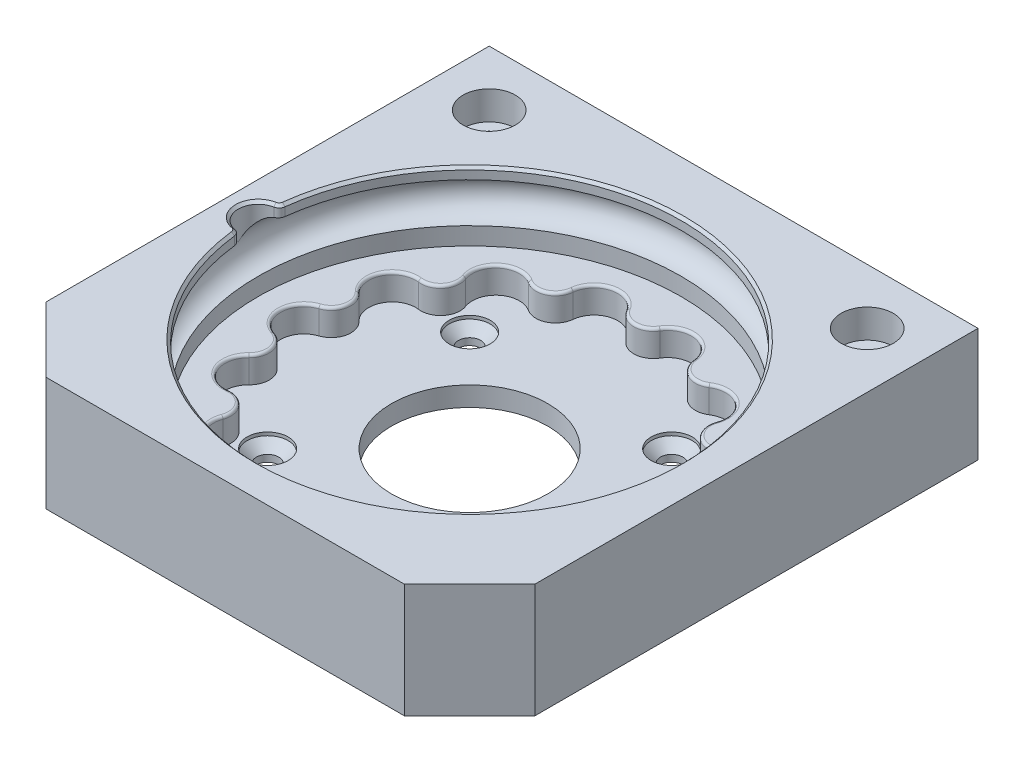
from build123d import *

# Parameters (mm, degrees)
SKETCH3_W                                           = 75
SKETCH3_H                                           = 75
SKETCH3_R                                           = 4.1
BOSS_EXTRUDE1_DEPTH                                 = 3
SKETCH4_W                                           = 75
SKETCH4_H                                           = 75
SKETCH4_R                                           = 3
BOSS_EXTRUDE2_DEPTH                                 = 4
SKETCH5_W                                           = 75
SKETCH5_H                                           = 75
SKETCH5_R                                           = 32.45
BOSS_EXTRUDE3_DEPTH                                 = 10.5
CHAMFER1_SIZE                                       = 10
SKETCH11_R                                          = 3.05
CUT_EXTRUDE2_REACH                                  = 57.846
CUT_EXTRUDE2_END_MAJOR_RADIUS                       = 32.45
CUT_EXTRUDE2_END_MINOR_RADIUS                       = 3.05
SKETCH12_R                                          = 3.05
FILLET2_R                                           = 1
SKETCH14_R                                          = 12
CUT_EXTRUDE3_DEPTH                                  = 56.845769925
CSK_FOR_M3_COUNTERSUNK_FLAT_HEAD_SCR_2_COUNT        = 2
CSK_FOR_M3_COUNTERSUNK_FLAT_HEAD_SCR_2_PITCH        = 31
CSK_FOR_M3_COUNTERSUNK_FLAT_HEAD_SCR_3_COUNT        = 2
CSK_FOR_M3_COUNTERSUNK_FLAT_HEAD_SCR_3_PITCH        = 43.840620434
CSK_FOR_M3_COUNTERSUNK_FLAT_HEAD_SCR_4_COUNT        = 2
CSK_FOR_M3_COUNTERSUNK_FLAT_HEAD_SCR_4_PITCH        = 31
CHAMFER2_SIZE                                       = 0.4
FILLET3_R                                           = 0.4
SKETCH17_W                                          = 75
SKETCH17_H                                          = 17.5
BOSS_EXTRUDE4_DEPTH                                 = 3
CBORE_FOR_M4_HEX_SOCKET_HEAD_CAP_SCREW1_D           = 4.5
CBORE_FOR_M4_HEX_SOCKET_HEAD_CAP_SCREW1_CBORE_D     = 8
CBORE_FOR_M4_HEX_SOCKET_HEAD_CAP_SCREW1_CBORE_DEPTH = 4.4


with BuildPart() as part:
    # Sketch3 → Boss-Extrude1 (new body)
    with BuildSketch(Plane(origin=(0, 0, 0), x_dir=(1, 0, 0), z_dir=(0, 1, 0))):
        Rectangle(SKETCH3_W, SKETCH3_H)
        with Locations(Location((0, 0, 0), (0, 0, 270))):
            Circle(SKETCH3_R, mode=Mode.SUBTRACT)
    extrude(amount=BOSS_EXTRUDE1_DEPTH)

    # Sketch4 → Boss-Extrude2 (add)
    # profile 1 of 15: a face of its own
    with BuildSketch(Plane(origin=(0, 3, 0), x_dir=(1, 0, 0), z_dir=(0, 1, 0))):
        Rectangle(SKETCH4_W, SKETCH4_H)
        with BuildLine():
            ThreePointArc((26.543765328, -3.429213328), (29.246876273, -3.841204002), (30.492967124, -6.275090338))
            ThreePointArc((30.492967124, -6.275090338), (28.661311449, -9.038235563), (25.402986098, -8.4272937))
            ThreePointArc((25.402986098, -8.4272937), (26.141546674, -12.589105375), (22.427226296, -14.606522601))
            ThreePointArc((22.427226296, -14.606522601), (24.299173452, -15.599830191), (25.047647806, -17.582412412))
            ThreePointArc((25.047647806, -17.582412412), (22.571841643, -20.536260889), (19.230833925, -18.614671858))
            ThreePointArc((19.230833925, -18.614671858), (18.0905116, -22.684784035), (13.868700044, -22.890830935))
            ThreePointArc((13.868700044, -22.890830935), (14.871762688, -23.975458919), (15.235521443, -25.407322075))
            ThreePointArc((15.235521443, -25.407322075), (12.089279525, -28.403755505), (9.249779242, -25.11518596))
            ThreePointArc((9.249779242, -25.11518596), (6.456428838, -28.287463006), (2.563307661, -26.641329465))
            ThreePointArc((2.563307661, -26.641329465), (2.8887647, -27.390655507), (3, -28.2))
            ThreePointArc((3, -28.2), (-0.809344493, -31.0887647), (-2.563307661, -26.641329465))
            ThreePointArc((-2.563307661, -26.641329465), (-6.456428838, -28.287463006), (-9.249779242, -25.11518596))
            ThreePointArc((-9.249779242, -25.11518596), (-9.239088013, -25.261080157), (-9.235521443, -25.407322075))
            ThreePointArc((-9.235521443, -25.407322075), (-13.667384599, -28.04356332), (-13.868700044, -22.890830935))
            ThreePointArc((-13.868700044, -22.890830935), (-18.0905116, -22.684784035), (-19.230833925, -18.614671858))
            ThreePointArc((-19.230833925, -18.614671858), (-24.393142253, -19.452881818), (-22.427226296, -14.606522601))
            ThreePointArc((-22.427226296, -14.606522601), (-26.141546674, -12.589105375), (-25.402986098, -8.4272937))
            ThreePointArc((-25.402986098, -8.4272937), (-30.41775086, -6.942653139), (-26.543765328, -3.429213328))
            ThreePointArc((-26.543765328, -3.429213328), (-29.014927825, 0), (-26.543765328, 3.429213328))
            ThreePointArc((-26.543765328, 3.429213328), (-30.41775086, 6.942653139), (-25.402986098, 8.4272937))
            ThreePointArc((-25.402986098, 8.4272937), (-26.141546674, 12.589105375), (-22.427226296, 14.606522601))
            ThreePointArc((-22.427226296, 14.606522601), (-24.393142253, 19.452881818), (-19.230833925, 18.614671858))
            ThreePointArc((-19.230833925, 18.614671858), (-18.0905116, 22.684784035), (-13.868700044, 22.890830935))
            ThreePointArc((-13.868700044, 22.890830935), (-13.667384599, 28.04356332), (-9.235521443, 25.407322075))
            ThreePointArc((-9.235521443, 25.407322075), (-9.239088013, 25.261080157), (-9.249779242, 25.11518596))
            ThreePointArc((-9.249779242, 25.11518596), (-6.456428838, 28.287463006), (-2.563307661, 26.641329465))
            ThreePointArc((-2.563307661, 26.641329465), (-0.809344493, 31.0887647), (3, 28.2))
            ThreePointArc((3, 28.2), (2.8887647, 27.390655507), (2.563307661, 26.641329465))
            ThreePointArc((2.563307661, 26.641329465), (6.456428838, 28.287463006), (9.249779242, 25.11518596))
            ThreePointArc((9.249779242, 25.11518596), (12.089279525, 28.403755505), (15.235521443, 25.407322075))
            ThreePointArc((15.235521443, 25.407322075), (14.871762688, 23.975458919), (13.868700044, 22.890830935))
            ThreePointArc((13.868700044, 22.890830935), (18.0905116, 22.684784035), (19.230833925, 18.614671858))
            ThreePointArc((19.230833925, 18.614671858), (22.571841643, 20.536260889), (25.047647806, 17.582412412))
            ThreePointArc((25.047647806, 17.582412412), (24.299173452, 15.599830191), (22.427226296, 14.606522601))
            ThreePointArc((22.427226296, 14.606522601), (26.141546674, 12.589105375), (25.402986098, 8.4272937))
            ThreePointArc((25.402986098, 8.4272937), (28.661311449, 9.038235563), (30.492967124, 6.275090338))
            ThreePointArc((30.492967124, 6.275090338), (29.246876273, 3.841204002), (26.543765328, 3.429213328))
            ThreePointArc((26.543765328, 3.429213328), (29.014927825, 0), (26.543765328, -3.429213328))
        make_face(mode=Mode.SUBTRACT)
    # profile 2 of 15: a face of its own
    with BuildSketch(Plane(origin=(0, 3, 0), x_dir=(1, 0, 0), z_dir=(0, 1, 0))):
        with Locations((22.047647806, 17.582412412)):
            Circle(SKETCH4_R)
    # profile 3 of 15: a face of its own
    with BuildSketch(Plane(origin=(0, 3, 0), x_dir=(1, 0, 0), z_dir=(0, 1, 0))):
        with Locations((27.492967124, 6.275090338)):
            Circle(SKETCH4_R)
    # profile 4 of 15: a face of its own
    with BuildSketch(Plane(origin=(0, 3, 0), x_dir=(1, 0, 0), z_dir=(0, 1, 0))):
        with Locations((27.492967124, -6.275090338)):
            Circle(SKETCH4_R)
    # profile 5 of 15: a face of its own
    with BuildSketch(Plane(origin=(0, 3, 0), x_dir=(1, 0, 0), z_dir=(0, 1, 0))):
        with Locations((22.047647806, -17.582412412)):
            Circle(SKETCH4_R)
    # profile 6 of 15: a face of its own
    with BuildSketch(Plane(origin=(0, 3, 0), x_dir=(1, 0, 0), z_dir=(0, 1, 0))):
        with Locations((12.235521443, -25.407322075)):
            Circle(SKETCH4_R)
    # profile 7 of 15: a face of its own
    with BuildSketch(Plane(origin=(0, 3, 0), x_dir=(1, 0, 0), z_dir=(0, 1, 0))):
        with Locations((0, -28.2)):
            Circle(SKETCH4_R)
    # profile 8 of 15: a face of its own
    with BuildSketch(Plane(origin=(0, 3, 0), x_dir=(1, 0, 0), z_dir=(0, 1, 0))):
        with Locations((-12.235521443, -25.407322075)):
            Circle(SKETCH4_R)
    # profile 9 of 15: a face of its own
    with BuildSketch(Plane(origin=(0, 3, 0), x_dir=(1, 0, 0), z_dir=(0, 1, 0))):
        with Locations((-22.047647806, -17.582412412)):
            Circle(SKETCH4_R)
    # profile 10 of 15: a face of its own
    with BuildSketch(Plane(origin=(0, 3, 0), x_dir=(1, 0, 0), z_dir=(0, 1, 0))):
        with Locations((-27.492967124, -6.275090338)):
            Circle(SKETCH4_R)
    # profile 11 of 15: a face of its own
    with BuildSketch(Plane(origin=(0, 3, 0), x_dir=(1, 0, 0), z_dir=(0, 1, 0))):
        with Locations((-27.492967124, 6.275090338)):
            Circle(SKETCH4_R)
    # profile 12 of 15: a face of its own
    with BuildSketch(Plane(origin=(0, 3, 0), x_dir=(1, 0, 0), z_dir=(0, 1, 0))):
        with Locations((-22.047647806, 17.582412412)):
            Circle(SKETCH4_R)
    # profile 13 of 15: a face of its own
    with BuildSketch(Plane(origin=(0, 3, 0), x_dir=(1, 0, 0), z_dir=(0, 1, 0))):
        with Locations((-12.235521443, 25.407322075)):
            Circle(SKETCH4_R)
    # profile 14 of 15: a face of its own
    with BuildSketch(Plane(origin=(0, 3, 0), x_dir=(1, 0, 0), z_dir=(0, 1, 0))):
        with Locations((0, 28.2)):
            Circle(SKETCH4_R)
    # profile 15 of 15: a face of its own
    with BuildSketch(Plane(origin=(0, 3, 0), x_dir=(1, 0, 0), z_dir=(0, 1, 0))):
        with Locations((12.235521443, 25.407322075)):
            Circle(SKETCH4_R)
    extrude(amount=BOSS_EXTRUDE2_DEPTH)

    # Sketch5 → Boss-Extrude3 (add)
    with BuildSketch(Plane(origin=(0, 7, 0), x_dir=(1, 0, 0), z_dir=(0, 1, 0))):
        Rectangle(SKETCH5_W, SKETCH5_H)
        with Locations(Location((0, 0, 0), (0, 0, 90))):
            Circle(SKETCH5_R, mode=Mode.SUBTRACT)
    extrude(amount=BOSS_EXTRUDE3_DEPTH)

    # Chamfer1
    chamfer1_edges = [part.edges().sort_by_distance(p)[0] for p in [
        (37.5, 8.75, 37.5),
        (-37.5, 8.75, 37.5),
    ]]
    chamfer(chamfer1_edges, length=CHAMFER1_SIZE)

    # Sketch11 → Cut-Revolve1 (revolve, cut)
    with BuildSketch(Plane.XY, mode=Mode.PRIVATE) as cut_revolve1_sk:
        with Locations((-32.45, 12.75)):
            Circle(SKETCH11_R)
    revolve(cut_revolve1_sk.sketch.rotate(Axis((0, 0, 0), (0, 1, 0)), 270), axis=Axis((0, 0, 0), (0, 1, 0)), mode=Mode.SUBTRACT)

    # Cut-Extrude2: up to this torus (the profile starts outside it)
    cut_extrude2_end = Plane(origin=(0, 12.75, 0), z_dir=(0, -1, 0)) * Torus(CUT_EXTRUDE2_END_MAJOR_RADIUS, CUT_EXTRUDE2_END_MINOR_RADIUS, mode=Mode.PRIVATE)
    # Sketch12 → Cut-Extrude2 (cut, up to the surface)
    with BuildSketch(Plane(origin=(0, 17.5, 0), x_dir=(1, 0, 0), z_dir=(0, 1, 0)), mode=Mode.PRIVATE) as cut_extrude2_sk1:
        with Locations((-32.45, 0)):
            Circle(SKETCH12_R)
    cut_extrude2_tool1 = extrude(cut_extrude2_sk1.sketch, amount=-CUT_EXTRUDE2_REACH, mode=Mode.PRIVATE) - cut_extrude2_end
    add(cut_extrude2_tool1.solids().sort_by_distance((-32.45, 17.5, 0))[0], mode=Mode.SUBTRACT)

    # Fillet2
    fillet2_edges = [part.edges().sort_by_distance(p)[0] for p in [
        (-32.306664099, 16.649999995, -3.046630076),
        (-32.306664099, 16.649999995, 3.046630076),
    ]]
    fillet(fillet2_edges, radius=FILLET2_R)

    # Sketch14 → Cut-Extrude3 (cut, through all)
    with BuildSketch(Plane.XZ):
        with Locations(Location((0, 0, 0), (0, 0, 270))):
            Circle(SKETCH14_R)
    extrude(amount=-CUT_EXTRUDE3_DEPTH, mode=Mode.SUBTRACT)

    # Sketch16 → CSK for M3 Countersunk Flat Head Screw1 (revolve, cut)
    with BuildSketch(Plane(origin=(-15.5, 3, -15.5), x_dir=(0, 0, 1), z_dir=(1, 0, 0))):
        Polygon((0, 0), (0, 3), (1.7, 3), (1.7, 1.95), (3.15, 0.5), (3.15, 0), align=None)
    csk_for_m3_countersunk_flat_head_screw1 = revolve(axis=Axis((-15.5, 9.35, -15.5), (0, -1, 0)), mode=Mode.SUBTRACT)

    # CSK for M3 Countersunk Flat Head Scr 2: CSK for M3 Countersunk Flat Head Screw1 ×2
    with Locations(*[(i * CSK_FOR_M3_COUNTERSUNK_FLAT_HEAD_SCR_2_PITCH, 0, 0) for i in range(1, CSK_FOR_M3_COUNTERSUNK_FLAT_HEAD_SCR_2_COUNT)]):
        add(csk_for_m3_countersunk_flat_head_screw1, mode=Mode.SUBTRACT)

    # CSK for M3 Countersunk Flat Head Scr 3: CSK for M3 Countersunk Flat Head Screw1 ×2
    with Locations(*[Vector(0.7071067811865476, 0, 0.7071067811865476) * (i * CSK_FOR_M3_COUNTERSUNK_FLAT_HEAD_SCR_3_PITCH) for i in range(1, CSK_FOR_M3_COUNTERSUNK_FLAT_HEAD_SCR_3_COUNT)]):
        add(csk_for_m3_countersunk_flat_head_screw1, mode=Mode.SUBTRACT)

    # CSK for M3 Countersunk Flat Head Scr 4: CSK for M3 Countersunk Flat Head Screw1 ×2
    with Locations(*[(0, 0, i * CSK_FOR_M3_COUNTERSUNK_FLAT_HEAD_SCR_4_PITCH) for i in range(1, CSK_FOR_M3_COUNTERSUNK_FLAT_HEAD_SCR_4_COUNT)]):
        add(csk_for_m3_countersunk_flat_head_screw1, mode=Mode.SUBTRACT)

    # Chamfer2
    chamfer2_edges = [part.edges().sort_by_distance(p)[0] for p in [
        (-35.5, 17.5, 0),
        (32.45, 17.5, 0),
        (-32.481169505, 17.5, -3.295703296),
        (-32.481169505, 17.5, 3.295703296),
    ]]
    chamfer(chamfer2_edges, length=CHAMFER2_SIZE)

    # Fillet3
    fillet3_edges = [part.edges().sort_by_distance(p)[0] for p in [
        (-26.141546674, 7, 12.589105375),
        (-29.014927825, 7, 0),
        (-26.141546674, 7, -12.589105375),
        (-18.0905116, 7, -22.684784035),
        (-6.456428838, 7, -28.287463006),
        (6.456428838, 7, -28.287463006),
        (18.0905116, 7, -22.684784035),
        (26.141546674, 7, -12.589105375),
        (29.014927825, 7, 0),
        (26.141546674, 7, 12.589105375),
        (18.0905116, 7, 22.684784035),
        (6.456428838, 7, 28.287463006),
        (-6.456428838, 7, 28.287463006),
        (-18.0905116, 7, 22.684784035),
        (-24.568183387, 7, 5.607527536),
        (-24.568183387, 7, -5.607527536),
        (-19.702153358, 7, -15.711943007),
        (-10.933870226, 7, -22.704415471),
        (0, 7, -25.2),
        (10.933870226, 7, -22.704415471),
        (19.702153358, 7, -15.711943007),
        (24.568183387, 7, -5.607527536),
        (24.568183387, 7, 5.607527536),
        (19.702153358, 7, 15.711943007),
        (10.933870226, 7, 22.704415471),
        (0, 7, 25.2),
        (-10.933870226, 7, 22.704415471),
        (-19.702153358, 7, 15.711943007),
    ]]
    fillet(fillet3_edges, radius=FILLET3_R)

    # Sketch17 → Boss-Extrude4 (add)
    with BuildSketch(Plane(origin=(0, 0, -37.5), x_dir=(-1, 0, 0), z_dir=(0, 0, -1))):
        with Locations((0, 8.75)):
            Rectangle(SKETCH17_W, SKETCH17_H)
    extrude(amount=BOSS_EXTRUDE4_DEPTH)

    # CBORE for M4 Hex Socket Head Cap Screw1 (through all)
    with Locations(Plane(origin=(0, 17.5, 0), x_dir=(1, 0, 0), z_dir=(0, 1, 0))):
        with Locations((-29, 32), (29, 32)):
            CounterBoreHole(CBORE_FOR_M4_HEX_SOCKET_HEAD_CAP_SCREW1_D / 2, CBORE_FOR_M4_HEX_SOCKET_HEAD_CAP_SCREW1_CBORE_D / 2, CBORE_FOR_M4_HEX_SOCKET_HEAD_CAP_SCREW1_CBORE_DEPTH)


solid = part.part
